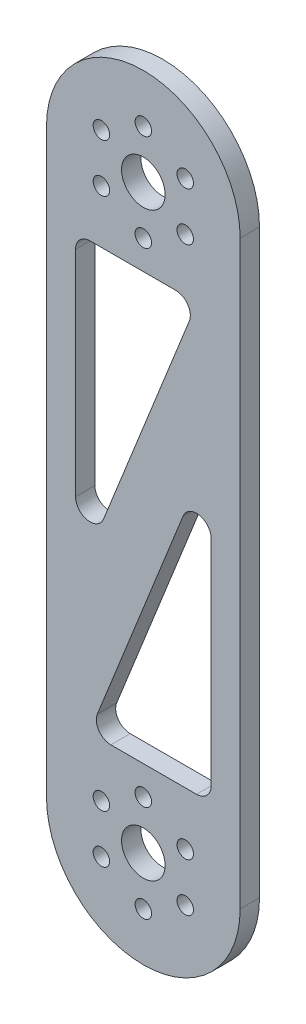
from build123d import *

# Parameters (mm, degrees)
SKETCH_1_R          = 4.5
EXTRUDE_2_DEPTH     = 4
CUT_EXTRUDE_1_DEPTH = 83.559069762
FILLET_1_R          = 3
SKETCH_6_R          = 1.7
CUT_EXTRUDE_2_DEPTH = 83.559069762


with BuildPart() as part:
    # 草图1 → 凸台-拉伸2 (new body)
    with BuildSketch(Plane.XY):
        with BuildLine():
            Line((20, -60), (20, 60))
            ThreePointArc((20, 60), (0, 80), (-20, 60))
            Line((-20, 60), (-20, -60))
            ThreePointArc((-20, -60), (0, -80), (20, -60))
        make_face()
        with Locations((0, 60)):
            Circle(SKETCH_1_R, mode=Mode.SUBTRACT)
        with Locations((0, -60)):
            Circle(SKETCH_1_R, mode=Mode.SUBTRACT)
    extrude(amount=EXTRUDE_2_DEPTH)

    # 草图4 → 切除-拉伸1 (cut, through all)
    with BuildSketch(Plane.XY.offset(4)):
        Polygon((-14, -18.844505579), (11.137802231, 44), (-14, 44), align=None)
        Polygon((14, -44), (14, 18.844505579), (-11.137802231, -44), align=None)
    extrude(amount=-CUT_EXTRUDE_1_DEPTH, mode=Mode.SUBTRACT)

    # 圆角1
    fillet_1_edges = [part.edges().sort_by_distance(p)[0] for p in [
        (14, -44, 2),
        (-11.137802231, -44, 2),
        (14, 18.844505579, 2),
        (-14, -18.844505579, 2),
        (-14, 44, 2),
        (11.137802231, 44, 2),
    ]]
    fillet(fillet_1_edges, radius=FILLET_1_R)

    # 草图6 → 切除-拉伸2 (cut, through all)
    with BuildSketch(Plane.XY.offset(4)):
        with Locations((0, 50)):
            Circle(SKETCH_6_R)
        with Locations((-8.660254038, 55)):
            Circle(SKETCH_6_R)
        with Locations((-8.660254038, 65)):
            Circle(SKETCH_6_R)
        with Locations((0, 70)):
            Circle(SKETCH_6_R)
        with Locations((8.660254038, 65)):
            Circle(SKETCH_6_R)
        with Locations((8.660254038, 55)):
            Circle(SKETCH_6_R)
        with Locations(Location((0, -70, 0), (0, 0, 180))):
            Circle(SKETCH_6_R)
        with Locations(Location((-8.660254038, -65, 0), (0, 0, 180))):
            Circle(SKETCH_6_R)
        with Locations(Location((-8.660254038, -55, 0), (0, 0, 180))):
            Circle(SKETCH_6_R)
        with Locations(Location((0, -50, 0), (0, 0, 180))):
            Circle(SKETCH_6_R)
        with Locations(Location((8.660254038, -55, 0), (0, 0, 180))):
            Circle(SKETCH_6_R)
        with Locations(Location((8.660254038, -65, 0), (0, 0, 180))):
            Circle(SKETCH_6_R)
    extrude(amount=-CUT_EXTRUDE_2_DEPTH, mode=Mode.SUBTRACT)


solid = part.part
